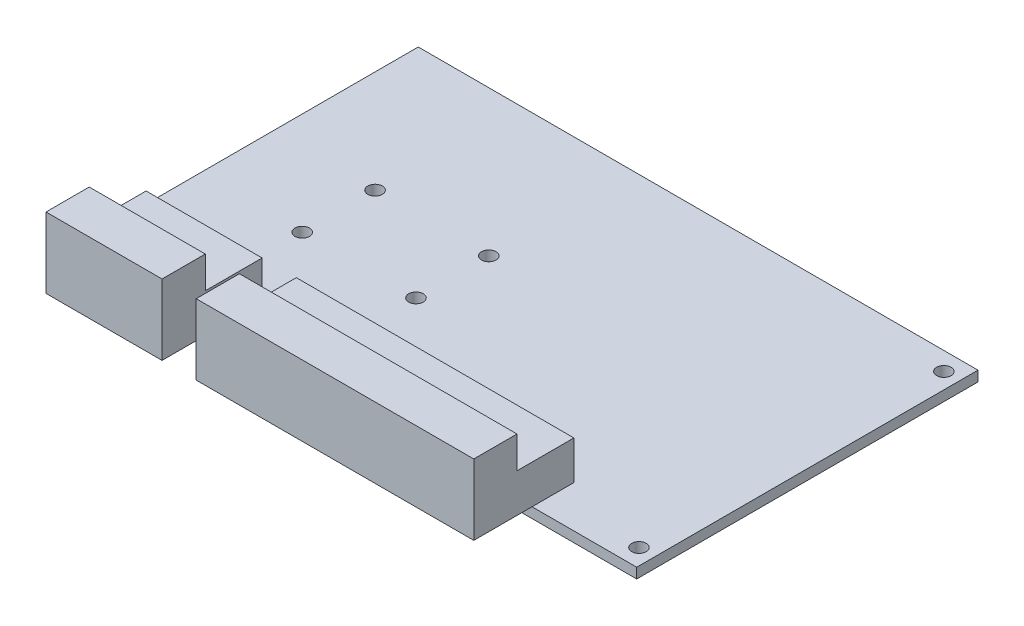
from build123d import *

# Parameters (mm, degrees)
SKETCH1_W           = 123
SKETCH1_H           = 75
SKETCH1_R           = 1.6
BOSS_EXTRUDE1_DEPTH = 2.25
SKETCH2_W           = 25.5
SKETCH2_H           = 22
SKETCH2_W_2         = 61
BOSS_EXTRUDE2_DEPTH = 8.5
SKETCH3_W           = 25.5
SKETCH3_H           = 9.5
SKETCH3_W_2         = 61
BOSS_EXTRUDE3_DEPTH = 7


with BuildPart() as part:
    # Sketch1 → Boss-Extrude1 (new body)
    with BuildSketch(Plane(origin=(0, 0, 0), x_dir=(1, 0, 0), z_dir=(0, 1, 0))):
        with Locations((61.5, 37.5)):
            Rectangle(SKETCH1_W, SKETCH1_H)
        with Locations(Location((119.5, 71, 0), (0, 0, 270))):
            Circle(SKETCH1_R, mode=Mode.SUBTRACT)
        with Locations(Location((119.5, 4, 0), (0, 0, 270))):
            Circle(SKETCH1_R, mode=Mode.SUBTRACT)
        with Locations(Location((3.5, 4, 0), (0, 0, 270))):
            Circle(SKETCH1_R, mode=Mode.SUBTRACT)
        with Locations(Location((22.5, 43, 0), (0, 0, 270))):
            Circle(SKETCH1_R, mode=Mode.SUBTRACT)
        with Locations(Location((47.5, 43, 0), (0, 0, 270))):
            Circle(SKETCH1_R, mode=Mode.SUBTRACT)
        with Locations(Location((22.5, 27, 0), (0, 0, 270))):
            Circle(SKETCH1_R, mode=Mode.SUBTRACT)
        with Locations(Location((47.5, 27, 0), (0, 0, 270))):
            Circle(SKETCH1_R, mode=Mode.SUBTRACT)
    extrude(amount=BOSS_EXTRUDE1_DEPTH)

    # Sketch2 → Boss-Extrude2 (add)
    with BuildSketch(Plane(origin=(0, 2.25, 0), x_dir=(1, 0, 0), z_dir=(0, 1, 0))):
        with Locations((18.75, -1.8)):
            Rectangle(SKETCH2_W, SKETCH2_H)
        with Locations((69.5, -1.8)):
            Rectangle(SKETCH2_W_2, SKETCH2_H)
    extrude(amount=BOSS_EXTRUDE2_DEPTH)

    # Sketch3 → Boss-Extrude3 (add)
    with BuildSketch(Plane(origin=(0, 10.75, 0), x_dir=(1, 0, 0), z_dir=(0, 1, 0))):
        with Locations((18.75, -8.05)):
            Rectangle(SKETCH3_W, SKETCH3_H)
        with Locations((69.5, -8.05)):
            Rectangle(SKETCH3_W_2, SKETCH3_H)
    extrude(amount=BOSS_EXTRUDE3_DEPTH)


solid = part.part
